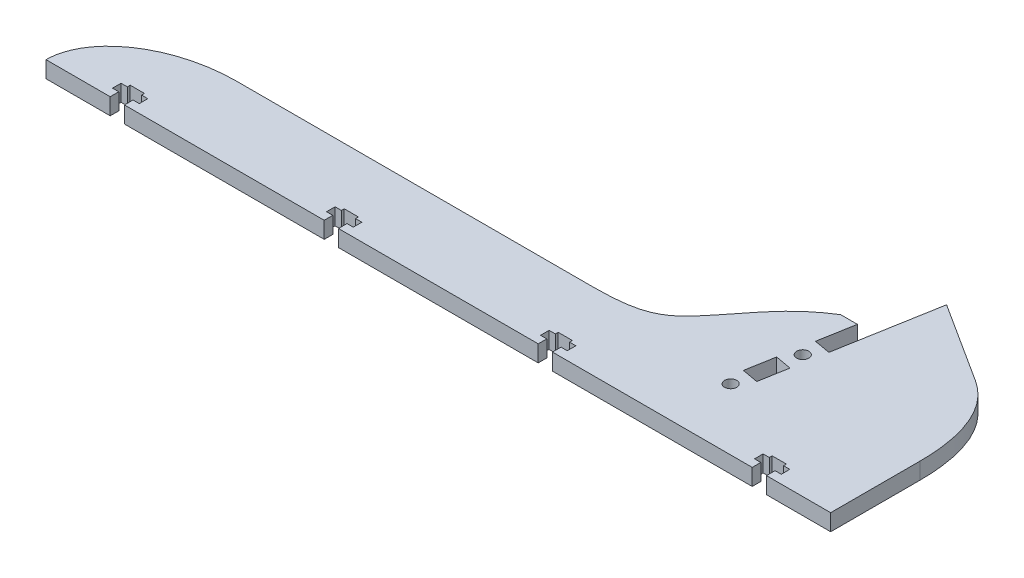
from build123d import *

# Parameters (mm, degrees)
SKETCH1_R           = 2.159
BOSS_EXTRUDE1_DEPTH = 5.8928


with BuildPart() as part:
    # Sketch1 → Boss-Extrude1 (new body)
    # profile 1 of 3: a face of its own
    with BuildSketch(Plane(origin=(0, 0, 0), x_dir=(1, 0, 0), z_dir=(0, 1, 0))):
        with BuildLine():
            Line((22.86, -56.388), (25.4, -56.388))
            Line((25.4, -56.388), (27.94, -56.388))
            Line((27.94, -56.388), (27.94, -57.404))
            Line((27.94, -57.404), (30.1625, -57.404))
            Line((30.1625, -57.404), (30.1625, -60.452))
            Line((30.1625, -60.452), (27.94, -60.452))
            Line((27.94, -60.452), (27.94, -63.5))
            Line((27.94, -63.5), (99.06, -63.5))
            Line((99.06, -63.5), (99.06, -60.452))
            Line((99.06, -60.452), (96.8375, -60.452))
            Line((96.8375, -60.452), (96.8375, -57.404))
            Line((96.8375, -57.404), (99.06, -57.404))
            Line((99.06, -57.404), (99.06, -56.388))
            Line((99.06, -56.388), (101.6, -56.388))
            Line((101.6, -56.388), (104.14, -56.388))
            Line((104.14, -56.388), (104.14, -57.404))
            Line((104.14, -57.404), (106.3625, -57.404))
            Line((106.3625, -57.404), (106.3625, -60.452))
            Line((106.3625, -60.452), (104.14, -60.452))
            Line((104.14, -60.452), (104.14, -63.5))
            Line((104.14, -63.5), (175.26, -63.5))
            Line((175.26, -63.5), (175.26, -60.452))
            Line((175.26, -60.452), (173.0375, -60.452))
            Line((173.0375, -60.452), (173.0375, -57.404))
            Line((173.0375, -57.404), (175.26, -57.404))
            Line((175.26, -57.404), (175.26, -56.388))
            Line((175.26, -56.388), (177.8, -56.388))
            Line((177.8, -56.388), (180.34, -56.388))
            Line((180.34, -56.388), (180.34, -57.404))
            Line((180.34, -57.404), (182.5625, -57.404))
            Line((182.5625, -57.404), (182.5625, -60.452))
            Line((182.5625, -60.452), (180.34, -60.452))
            Line((180.34, -60.452), (180.34, -63.5))
            Line((180.34, -63.5), (251.46, -63.5))
            Line((251.46, -63.5), (251.46, -60.452))
            Line((251.46, -60.452), (249.2375, -60.452))
            Line((249.2375, -60.452), (249.2375, -57.404))
            Line((249.2375, -57.404), (251.46, -57.404))
            Line((251.46, -57.404), (251.46, -56.388))
            Line((251.46, -56.388), (254, -56.388))
            Line((254, -56.388), (256.54, -56.388))
            Line((256.54, -56.388), (256.54, -57.404))
            Line((256.54, -57.404), (258.7625, -57.404))
            Line((258.7625, -57.404), (258.7625, -60.452))
            Line((258.7625, -60.452), (256.54, -60.452))
            Line((256.54, -60.452), (256.54, -63.5))
            Line((256.54, -63.5), (279.4, -63.5))
            Line((279.4, -63.5), (279.4, -31.75))
            add(Edge.make_bspline(
                [(268.339603776, 0), (275.019525549, -6.158991848), (279.385214725, -16.365397032), (279.4, -31.75)],
                knots=[0.805473307, 0.805473307, 0.805473307, 0.805473307, 1, 1, 1, 1], degree=3))
            Line((268.339603776, 0), (232.176763275, 0))
            Line((232.176763275, 0), (229.641134322, -14.380266384))
            Line((229.641134322, -14.380266384), (223.837859195, -13.356992403))
            Line((223.837859195, -13.356992403), (226.078012822, -0.652449861))
            Line((226.078012822, -0.652449861), (220.106261854, -0.652449861))
            add(Edge.make_bspline(
                [(167.647045609, -36.208320755), (182.540854706, -36.177050532), (193.471525933, -31.320671219), (205.978352833, -11.056890294), (216.80246247, -2.714612362), (220.106261854, -0.652449861)],
                knots=[0, 0, 0, 0, 0.18449289, 0.370391028, 0.445681017, 0.445681017, 0.445681017, 0.445681017], degree=3))
            Line((167.647045609, -36.208320755), (40.664262654, -36.208320755))
            add(Edge.make_bspline(
                [(40.664262654, -36.208320755), (0, -36.208320755), (0, -63.5)],
                knots=[1.570796327, 1.570796327, 1.570796327, 3.141592654, 3.141592654, 3.141592654], degree=2, weights=[1, 0.707106781, 1]))
            Line((0, -63.5), (22.86, -63.5))
            Line((22.86, -63.5), (22.86, -60.452))
            Line((22.86, -60.452), (20.6375, -60.452))
            Line((20.6375, -60.452), (20.6375, -57.404))
            Line((20.6375, -57.404), (22.86, -57.404))
            Line((22.86, -57.404), (22.86, -56.388))
        make_face()
        with Locations(Location((221.854115864, -41.575001242, 0), (0, 0, 270))):
            Circle(SKETCH1_R, mode=Mode.SUBTRACT)
        Polygon((221.76484725, -25.113627358), (227.568122377, -26.13690134), (225.7922594, -36.208320755), (219.988984273, -35.185046774), align=None, mode=Mode.SUBTRACT)
        with Locations(Location((225.702990786, -19.746946871, 0), (0, 0, 270))):
            Circle(SKETCH1_R, mode=Mode.SUBTRACT)
    # profile 2 of 3: a face of its own
    with BuildSketch(Plane(origin=(0, 0, 0), x_dir=(1, 0, 0), z_dir=(0, 1, 0))):
        with BuildLine():
            Line((233.123919707, 5.371591052), (232.176763275, 0))
            Line((232.176763275, 0), (268.339603776, 0))
            add(Edge.make_bspline(
                [(264.58250195, 2.898755616), (265.899962004, 2.055359977), (267.156104906, 1.091204379), (268.339603776, 0)],
                knots=[0.771008514, 0.771008514, 0.771008514, 0.771008514, 0.805473307, 0.805473307, 0.805473307, 0.805473307], degree=3))
            add(Edge.make_bspline(
                [(233.123919707, 5.371591052), (239.398286694, 7.344939742), (250.719959286, 8.655748308), (260.759413307, 5.346174252), (264.58250195, 2.898755616)],
                knots=[0.539626218, 0.539626218, 0.539626218, 0.539626218, 0.670996405, 0.771008514, 0.771008514, 0.771008514, 0.771008514], degree=3))
        make_face()
    # profile 3 of 3: a face of its own
    with BuildSketch(Plane(origin=(0, 0, 0), x_dir=(1, 0, 0), z_dir=(0, 1, 0))):
        with BuildLine():
            Line((235.922949985, 21.245680584), (233.123919707, 5.371591052))
            add(Edge.make_bspline(
                [(233.123919707, 5.371591052), (239.398286694, 7.344939742), (250.719959286, 8.655748308), (260.759413307, 5.346174252), (264.58250195, 2.898755616)],
                knots=[0.539626218, 0.539626218, 0.539626218, 0.539626218, 0.670996405, 0.771008514, 0.771008514, 0.771008514, 0.771008514], degree=3))
            Line((264.58250195, 2.898755616), (235.922949985, 21.245680584))
        make_face()
    extrude(amount=BOSS_EXTRUDE1_DEPTH)


solid = part.part
